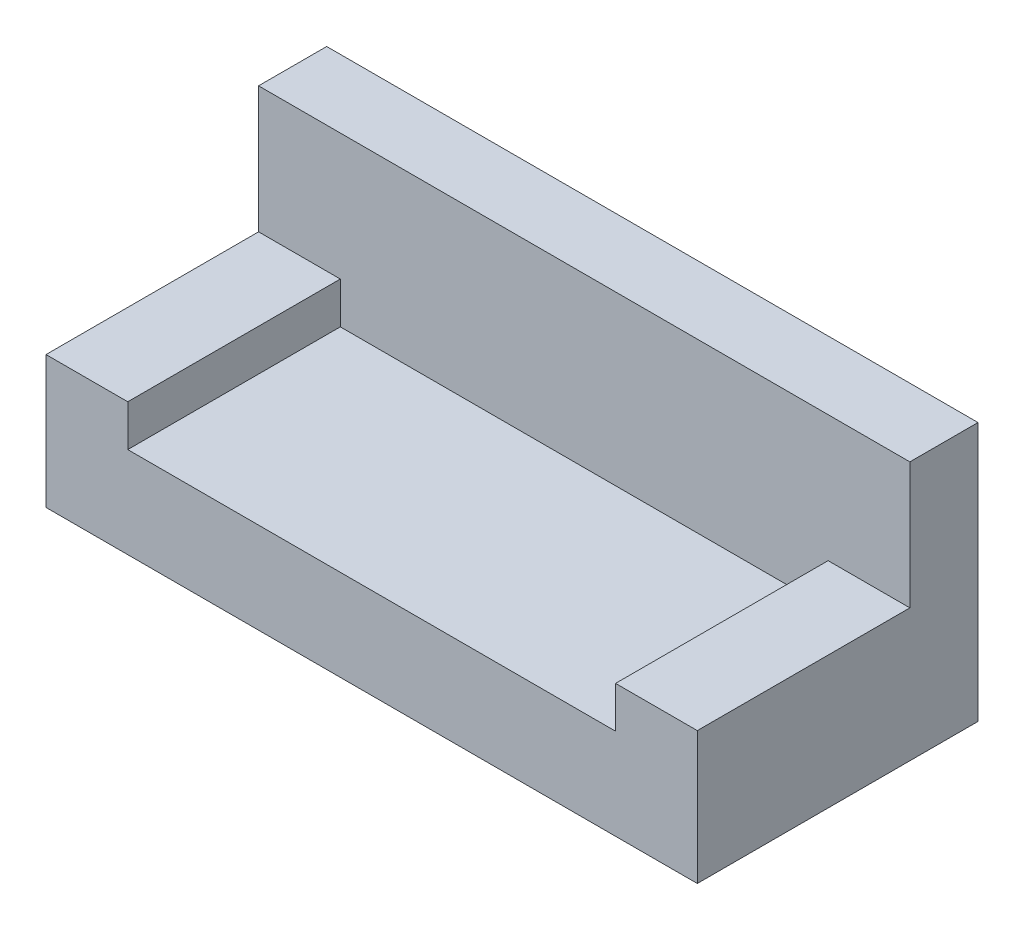
from build123d import *

# Parameters (mm, degrees)
SKETCH_1_W          = 2390
SKETCH_1_H          = 1030
EXTRUDE_1_DEPTH     = 950
SKETCH_2_W          = 1790
SKETCH_2_H          = 780
CUT_EXTRUDE_1_DEPTH = 616
SKETCH_3_W          = 300
SKETCH_3_H          = 780
CUT_EXTRUDE_2_DEPTH = 464


with BuildPart() as part:
    # Эскиз1 → Бобышка-Вытянуть1 (new body)
    with BuildSketch(Plane(origin=(0, 0, 0), x_dir=(1, 0, 0), z_dir=(0, 1, 0))):
        with Locations((1195, 515)):
            Rectangle(SKETCH_1_W, SKETCH_1_H)
    extrude(amount=EXTRUDE_1_DEPTH)

    # Эскиз2 → Вырез-Вытянуть1 (cut)
    with BuildSketch(Plane(origin=(0, 950, 0), x_dir=(1, 0, 0), z_dir=(0, 1, 0))):
        with Locations((1195, 390)):
            Rectangle(SKETCH_2_W, SKETCH_2_H)
    extrude(amount=-CUT_EXTRUDE_1_DEPTH, mode=Mode.SUBTRACT)

    # Эскиз3 → Вырез-Вытянуть2 (cut)
    with BuildSketch(Plane(origin=(0, 950, 0), x_dir=(1, 0, 0), z_dir=(0, 1, 0))):
        with Locations((150, 390)):
            Rectangle(SKETCH_3_W, SKETCH_3_H)
        with Locations((2240, 390)):
            Rectangle(SKETCH_3_W, SKETCH_3_H)
    extrude(amount=-CUT_EXTRUDE_2_DEPTH, mode=Mode.SUBTRACT)


solid = part.part
